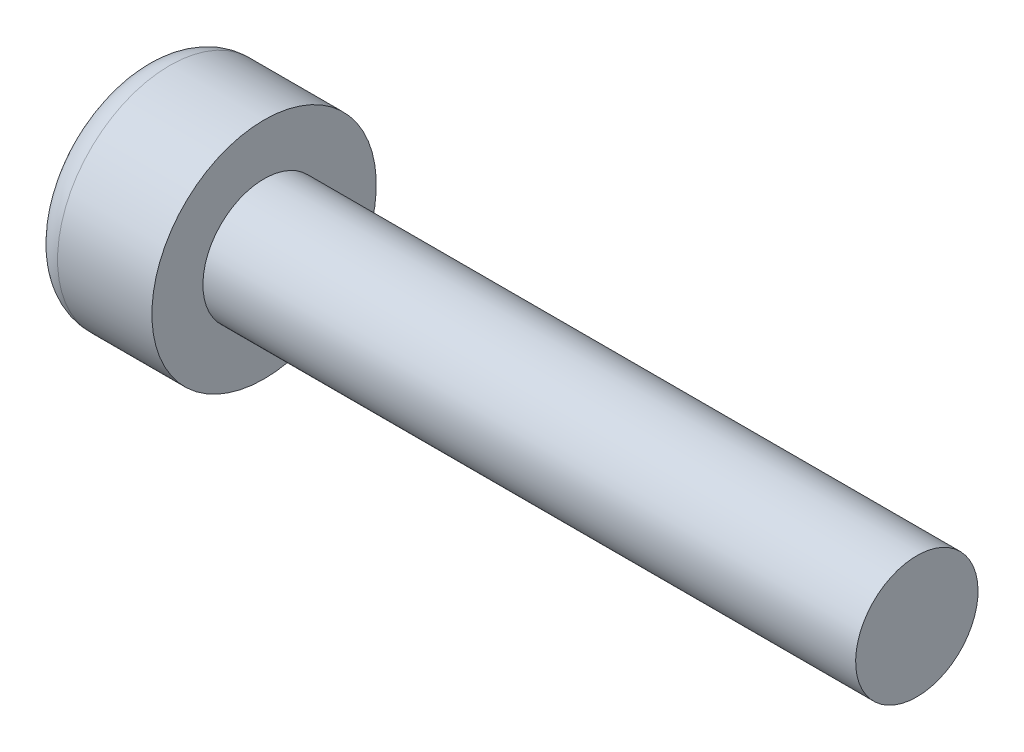
from build123d import *

# Parameters (mm, degrees)
CUT_EXTRUDE1_DEPTH = 1.5


with BuildPart() as part:
    # Sketch1 → Revolve1 (revolve)
    with BuildSketch(Plane.XY, mode=Mode.PRIVATE) as revolve1_sk:
        with BuildLine():
            Line((0, 0), (0, 2.0625))
            ThreePointArc((0, 2.0625), (0.201364088, 2.548635912), (0.6875, 2.75))
            Line((0.6875, 2.75), (3, 2.75))
            Line((3, 2.75), (3, 1.5))
            Line((3, 1.5), (19, 1.5))
            Line((19, 1.5), (19, 0))
            Line((19, 0), (0, 0))
        make_face()
    revolve(revolve1_sk.sketch.rotate(Axis((0, 0, 0), (1, 0, 0)), 180), axis=Axis((0, 0, 0), (1, 0, 0)))

    # Sketch2 → Cut-Extrude1 (cut)
    with BuildSketch(Plane.ZY):
        Polygon((0, 1.443375673), (-1.25, 0.721687836), (-1.25, -0.721687836), (0, -1.443375673), (1.25, -0.721687836), (1.25, 0.721687836), align=None)
    extrude(amount=-CUT_EXTRUDE1_DEPTH, mode=Mode.SUBTRACT)


solid = part.part
